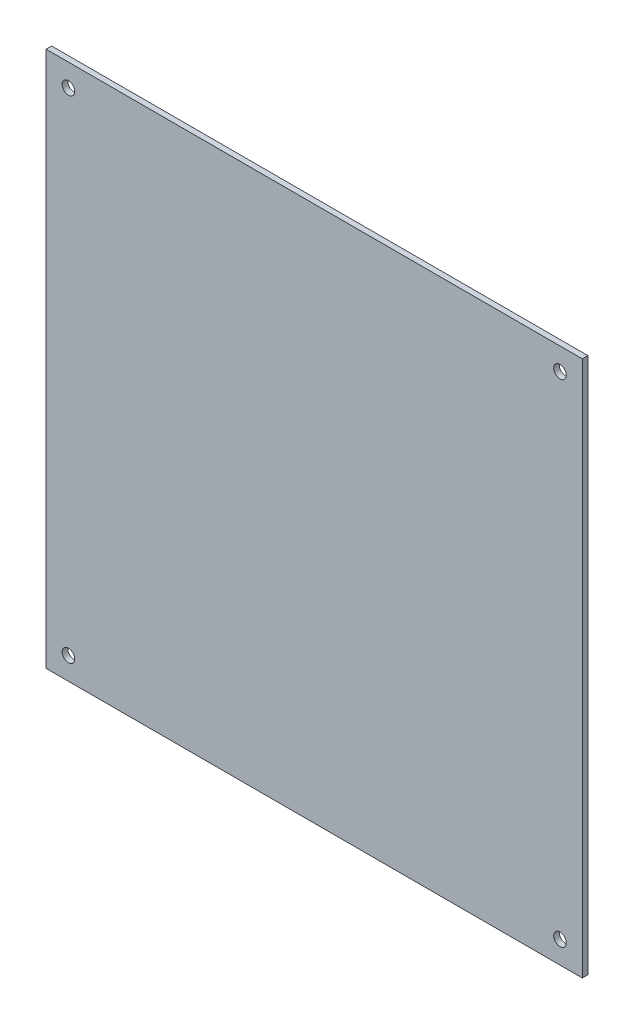
from build123d import *

# Parameters (mm, degrees)
SKETCH1_W               = 304.8
SKETCH1_H               = 304.8
BOSS_EXTRUDE1_DEPTH     = 3.175
F_1_4_CLEARANCE_HOLE1_D = 7.14248


with BuildPart() as part:
    # Sketch1 → Boss-Extrude1 (new body)
    with BuildSketch(Plane.XY):
        with Locations((152.4, -152.4)):
            Rectangle(SKETCH1_W, SKETCH1_H)
    extrude(amount=BOSS_EXTRUDE1_DEPTH)

    # 1/4 Clearance Hole1 (through all)
    with Locations(Plane.XY.offset(3.175)):
        with Locations((292.1, -292.1), (12.7, -12.7), (292.1, -12.7), (12.7, -292.1)):
            Hole(F_1_4_CLEARANCE_HOLE1_D / 2)


solid = part.part
